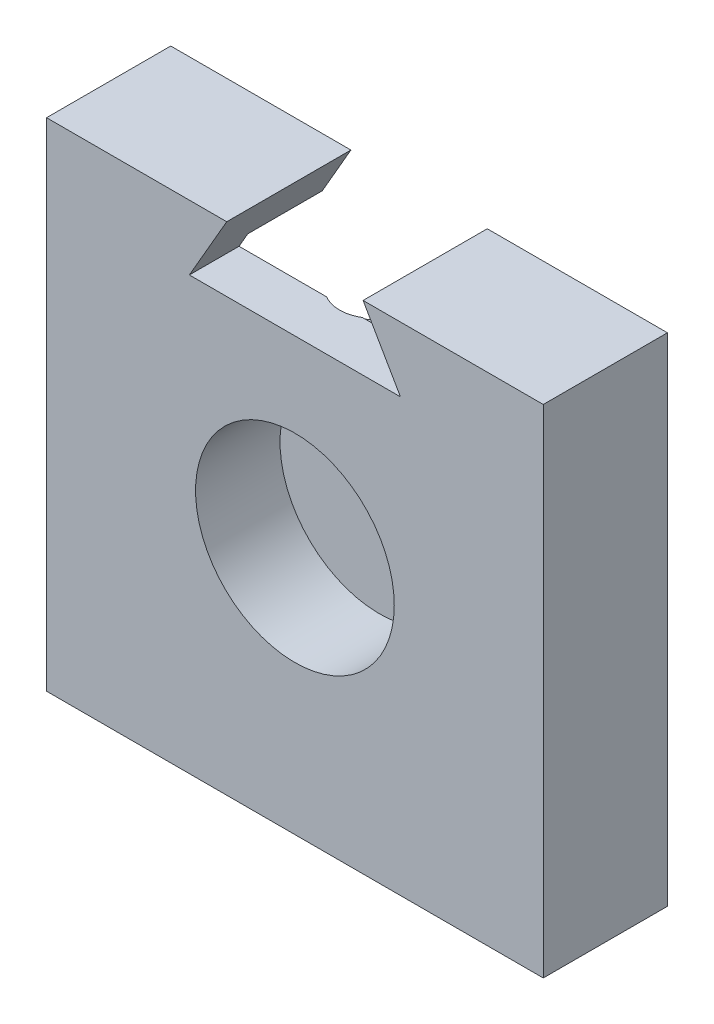
from build123d import *

# Parameters (mm, degrees)
SKETCH2_W           = 200
SKETCH2_H           = 200
BOSS_EXTRUDE1_DEPTH = 50
SHELL1_T            = -20
CUT_EXTRUDE1_DEPTH  = 50
SKETCH5_R           = 50
BOSS_EXTRUDE2_DEPTH = 28
SKETCH6_R           = 40
CUT_EXTRUDE2_DEPTH  = 34
SKETCH7_R           = 14
CUT_EXTRUDE4_DEPTH  = 46


with BuildPart() as part:
    # Sketch2 → Boss-Extrude1 (new body)
    with BuildSketch(Plane.XY):
        with Locations((-40.678946788, -125.067928938)):
            Rectangle(SKETCH2_W, SKETCH2_H)
    extrude(amount=-BOSS_EXTRUDE1_DEPTH)

    # Shell1
    shell1_openings = [part.faces().sort_by_distance(p)[0] for p in [
        (-40.678946788, -125.067928938, -50),
    ]]
    offset(amount=SHELL1_T, openings=shell1_openings, kind=Kind.INTERSECTION)

    # Sketch3 → Cut-Extrude1 (cut)
    with BuildSketch(Plane.XY):
        Polygon((-13.228603608, -25.067928938), (1.821053212, -51.157579637), (-83.178946788, -51.157579637), (-68.129289968, -25.067928938), align=None)
    extrude(amount=-CUT_EXTRUDE1_DEPTH, mode=Mode.SUBTRACT)

    # Sketch5 → Boss-Extrude2 (add)
    with BuildSketch(Plane(origin=(0, 0, -20), x_dir=(-1, 0, 0), z_dir=(0, 0, -1))):
        with Locations((40.678946788, -125.067928938)):
            Circle(SKETCH5_R)
    extrude(amount=BOSS_EXTRUDE2_DEPTH)

    # Sketch6 → Cut-Extrude2 (cut)
    with BuildSketch(Plane.XY):
        with Locations((-40.678946788, -125.067928938)):
            Circle(SKETCH6_R)
    extrude(amount=-CUT_EXTRUDE2_DEPTH, mode=Mode.SUBTRACT)

    # Sketch7 → Cut-Extrude4 (cut)
    with BuildSketch(Plane(origin=(0, -45.067928938, 0), x_dir=(-1, 0, 0), z_dir=(0, -1, 0))):
        with Locations(Location((40.678946788, 32, 0), (0, 0, 301.002719134))):
            Circle(SKETCH7_R)
    extrude(amount=CUT_EXTRUDE4_DEPTH, mode=Mode.SUBTRACT)


solid = part.part
